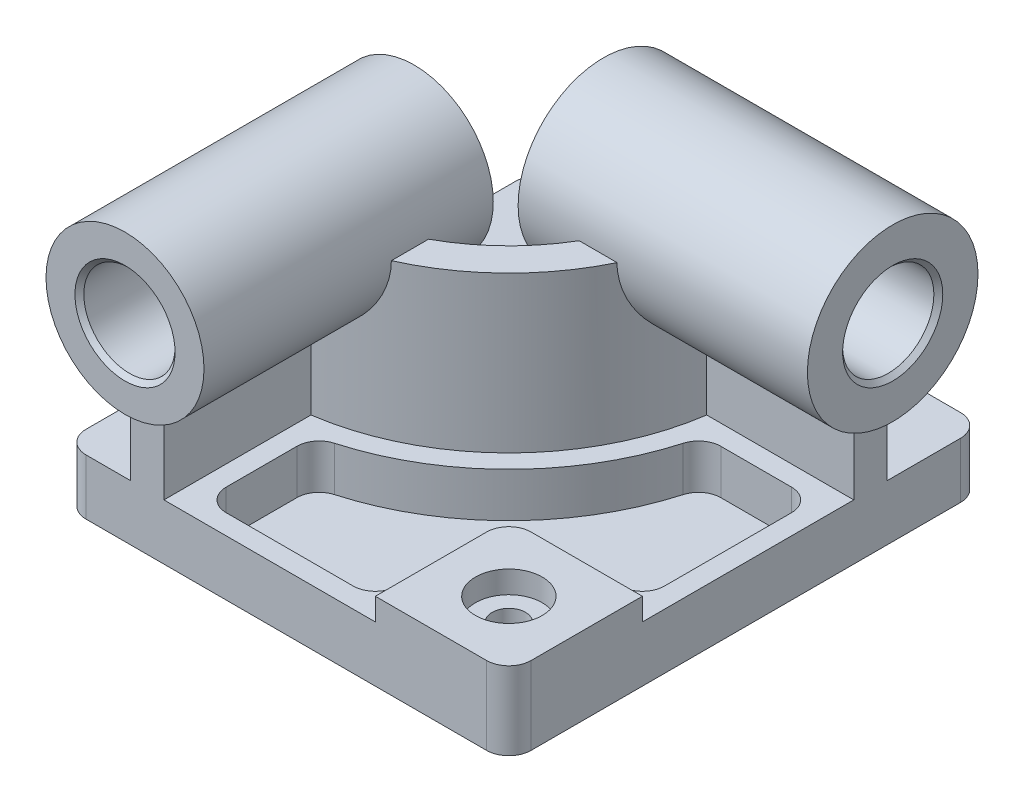
from build123d import *

# Parameters (mm, degrees)
BOSS_EXTRUDE1_DEPTH     = 95
BOSS_EXTRUDE2_DEPTH     = 25
BOSS_EXTRUDE3_DEPTH     = 35
CUT_EXTRUDE1_DEPTH      = 20
SKETCH4_R               = 38.333333333
SKETCH4_R_2             = 20.5
BOSS_EXTRUDE4_DEPTH     = 120
SKETCH5_R               = 35.5
SKETCH5_R_2             = 20.5
BOSS_EXTRUDE5_DEPTH     = 120
BOSS_EXTRUDE6_START     = 10
SKETCH6_R               = 35.5
SKETCH6_R_2             = 20.5
BOSS_EXTRUDE6_DEPTH     = 10
BOSS_EXTRUDE7_START     = 10
SKETCH7_R               = 38.333333333
SKETCH7_R_2             = 20.5
BOSS_EXTRUDE7_DEPTH     = 10
SKETCH8_R               = 20.5
CUT_EXTRUDE2_DEPTH      = 283.146731022
SKETCH9_R               = 20.5
CUT_EXTRUDE3_DEPTH      = 275.681684551
SKETCH10_R              = 15
CUT_EXTRUDE4_DEPTH      = 10
CUT_EXTRUDE5_DEPTH      = 194.412412161
CUT_EXTRUDE5_DEPTH_BACK = 194.412412161
SKETCH11_R              = 7.5
CHAMFER1_SIZE           = 2


with BuildPart() as part:
    # Sketch1 → Boss-Extrude1 (new body)
    with BuildSketch(Plane(origin=(0, 0, 0), x_dir=(1, 0, 0), z_dir=(0, 1, 0))):
        with BuildLine():
            Line((-70, -26.5), (-70, -106.5))
            Line((-70, -106.5), (-55, -106.5))
            Line((-55, -106.5), (-55, -40.423048454))
            ThreePointArc((-55, -40.423048454), (4.246212025, -10.746212025), (33.923048454, 48.5))
            Line((33.923048454, 48.5), (100, 48.5))
            Line((100, 48.5), (100, 63.5))
            Line((100, 63.5), (20, 63.5))
            ThreePointArc((20, 63.5), (-6.360389693, -0.139610307), (-70, -26.5))
        make_face()
    extrude(amount=BOSS_EXTRUDE1_DEPTH)

    # Sketch1<3> → Boss-Extrude2 (add)
    with BuildSketch(Plane(origin=(0, 0, 0), x_dir=(1, 0, 0), z_dir=(0, 1, 0))):
        with BuildLine():
            Line((-90, -106.5), (-70, -106.5))
            Line((-70, -106.5), (-70, -26.5))
            ThreePointArc((-70, -26.5), (-6.360389693, -0.139610307), (20, 63.5))
            Line((20, 63.5), (100, 63.5))
            Line((100, 63.5), (100, 96.5))
            ThreePointArc((100, 96.5), (97.071067812, 103.571067812), (90, 106.5))
            Line((90, 106.5), (-90, 106.5))
            ThreePointArc((-90, 106.5), (-97.071067812, 103.571067812), (-100, 96.5))
            Line((-100, 96.5), (-100, -96.5))
            ThreePointArc((-100, -96.5), (-97.071067812, -103.571067812), (-90, -106.5))
        make_face()
        with BuildLine():
            Line((-55, -40.423048454), (-55, -106.5))
            Line((-55, -106.5), (40, -106.5))
            Line((40, -106.5), (40, -56.5))
            ThreePointArc((40, -56.5), (42.928932188, -49.428932188), (50, -46.5))
            Line((50, -46.5), (100, -46.5))
            Line((100, -46.5), (100, 48.5))
            Line((100, 48.5), (33.923048454, 48.5))
            ThreePointArc((33.923048454, 48.5), (4.246212025, -10.746212025), (-55, -40.423048454))
        make_face()
    extrude(amount=BOSS_EXTRUDE2_DEPTH)

    # Sketch1<4> → Boss-Extrude3 (add)
    with BuildSketch(Plane(origin=(0, 0, 0), x_dir=(1, 0, 0), z_dir=(0, 1, 0))):
        with BuildLine():
            Line((40, -56.5), (40, -106.5))
            Line((40, -106.5), (90, -106.5))
            ThreePointArc((90, -106.5), (97.071067812, -103.571067812), (100, -96.5))
            Line((100, -96.5), (100, -46.5))
            Line((100, -46.5), (50, -46.5))
            ThreePointArc((50, -46.5), (42.928932188, -49.428932188), (40, -56.5))
        make_face()
    extrude(amount=BOSS_EXTRUDE3_DEPTH)

    # Sketch2 → Cut-Extrude1 (cut)
    with BuildSketch(Plane(origin=(0, 25, 0), x_dir=(1, 0, 0), z_dir=(0, 1, 0))):
        with BuildLine():
            Line((81, 39.5), (49.247641486, 39.5))
            ThreePointArc((49.247641486, 39.5), (43.223496519, 37.481834214), (39.630896205, 32.241935484))
            ThreePointArc((39.630896205, 32.241935484), (10.610173055, -17.110173055), (-38.741935484, -46.130896205))
            ThreePointArc((-38.741935484, -46.130896205), (-43.981834214, -49.723496519), (-46, -55.747641486))
            Line((-46, -55.747641486), (-46, -87.5))
            ThreePointArc((-46, -87.5), (-43.071067812, -94.571067812), (-36, -97.5))
            Line((-36, -97.5), (21, -97.5))
            ThreePointArc((21, -97.5), (28.071067812, -94.571067812), (31, -87.5))
            Line((31, -87.5), (31, -56.5))
            ThreePointArc((31, -56.5), (36.564971157, -43.064971157), (50, -37.5))
            Line((50, -37.5), (81, -37.5))
            ThreePointArc((81, -37.5), (88.071067812, -34.571067812), (91, -27.5))
            Line((91, -27.5), (91, 29.5))
            ThreePointArc((91, 29.5), (88.071067812, 36.571067812), (81, 39.5))
        make_face()
    extrude(amount=-CUT_EXTRUDE1_DEPTH, mode=Mode.SUBTRACT)

    # Sketch4 → Boss-Extrude4 (add)
    with BuildSketch(Plane(origin=(100, 0, 0), x_dir=(0, 0, -1), z_dir=(1, 0, 0))):
        with Locations((56, 95)):
            Circle(SKETCH4_R)
        with Locations((56, 95)):
            Circle(SKETCH4_R_2, mode=Mode.SUBTRACT)
    extrude(amount=-BOSS_EXTRUDE4_DEPTH)

    # Sketch5 → Boss-Extrude5 (add)
    with BuildSketch(Plane.XY.offset(106.5)):
        with Locations((-62.5, 95)):
            Circle(SKETCH5_R)
        with Locations((-62.5, 95)):
            Circle(SKETCH5_R_2, mode=Mode.SUBTRACT)
    extrude(amount=-BOSS_EXTRUDE5_DEPTH)

    # Sketch6 → Boss-Extrude6 (add)
    with BuildSketch(Plane.XY.offset(106.5).offset(BOSS_EXTRUDE6_START)):
        with Locations((-62.5, 95)):
            Circle(SKETCH6_R)
        with Locations((-62.5, 95)):
            Circle(SKETCH6_R_2, mode=Mode.SUBTRACT)
    extrude(amount=-BOSS_EXTRUDE6_DEPTH)

    # Sketch7 → Boss-Extrude7 (add)
    with BuildSketch(Plane(origin=(100, 0, 0), x_dir=(0, 0, -1), z_dir=(1, 0, 0)).offset(BOSS_EXTRUDE7_START)):
        with Locations((56, 95)):
            Circle(SKETCH7_R)
        with Locations((56, 95)):
            Circle(SKETCH7_R_2, mode=Mode.SUBTRACT)
    extrude(amount=-BOSS_EXTRUDE7_DEPTH)

    # Sketch8 → Cut-Extrude2 (cut, through all)
    with BuildSketch(Plane.XY.offset(116.5)):
        with Locations((-62.5, 95)):
            Circle(SKETCH8_R)
    extrude(amount=-CUT_EXTRUDE2_DEPTH, mode=Mode.SUBTRACT)

    # Sketch9 → Cut-Extrude3 (cut, through all)
    with BuildSketch(Plane(origin=(110, 0, 0), x_dir=(0, 0, -1), z_dir=(1, 0, 0))):
        with Locations((56, 95)):
            Circle(SKETCH9_R)
    extrude(amount=-CUT_EXTRUDE3_DEPTH, mode=Mode.SUBTRACT)

    # Sketch10 → Cut-Extrude4 (cut)
    with BuildSketch(Plane(origin=(0, 35, 0), x_dir=(1, 0, 0), z_dir=(0, 1, 0))):
        with Locations((70, -76.5)):
            Circle(SKETCH10_R)
    extrude(amount=-CUT_EXTRUDE4_DEPTH, mode=Mode.SUBTRACT)

    # Sketch11 → Cut-Extrude5 (cut, two sides: drawn at the far end of the back side and taken through both)
    with BuildSketch(Plane(origin=(0, 25, 0), x_dir=(1, 0, 0), z_dir=(0, 1, 0)).offset(-CUT_EXTRUDE5_DEPTH_BACK)):
        with Locations((70, -76.5)):
            Circle(SKETCH11_R)
    extrude(amount=CUT_EXTRUDE5_DEPTH + CUT_EXTRUDE5_DEPTH_BACK, mode=Mode.SUBTRACT)

    # Chamfer1
    chamfer1_edges = [part.edges().sort_by_distance(p)[0] for p in [
        (110, 95, -35.5),
        (-20, 95, -35.5),
        (-83, 95, -13.5),
        (-83, 95, 116.5),
    ]]
    chamfer(chamfer1_edges, length=CHAMFER1_SIZE)


solid = part.part
